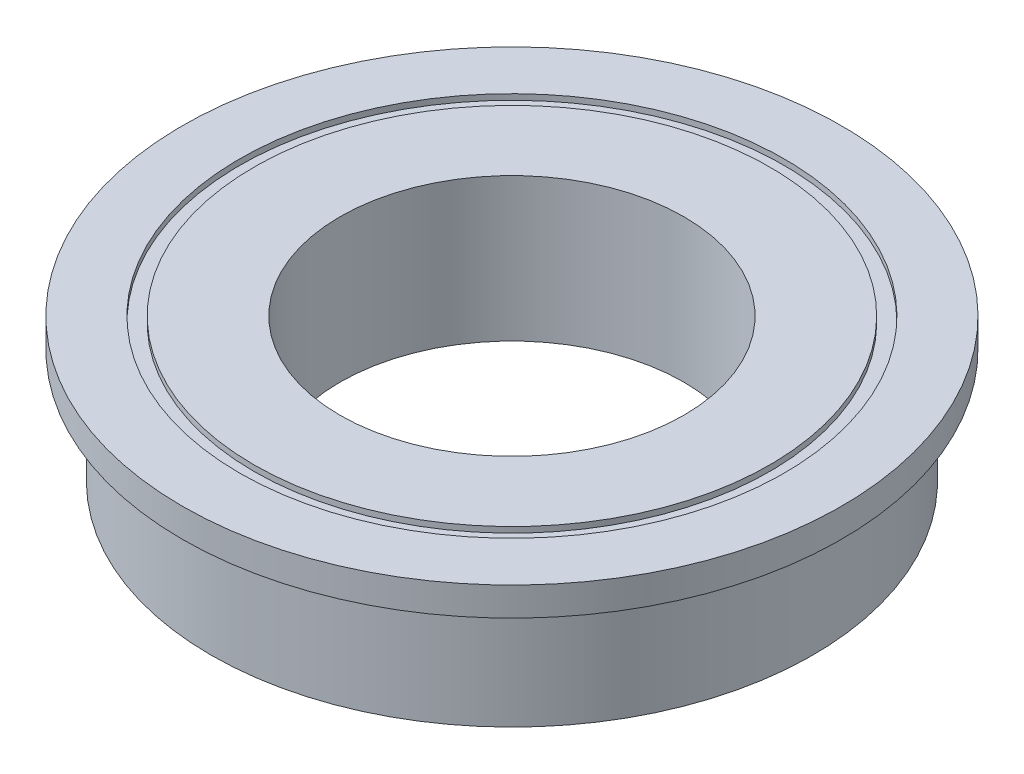
from build123d import *

# Parameters (mm, degrees)
SKETCH_1_R          = 10.5
SKETCH_1_R_2        = 6
EXTRUDE_1_DEPTH     = 4
SKETCH_2_R          = 11.5
SKETCH_2_R_2        = 6
EXTRUDE_2_DEPTH     = 1
SKETCH_3_R          = 9.5
SKETCH_3_R_2        = 9
CUT_EXTRUDE_1_DEPTH = 0.2
CUT_EXTRUDE_START   = -0.2
SKETCH_4_R          = 9.5
SKETCH_4_R_2        = 9
CUT_EXTRUDE_2_DEPTH = 0.2


with BuildPart() as part:
    # 草图1 → 凸台-拉伸1 (new body)
    with BuildSketch(Plane(origin=(0, 0, 0), x_dir=(1, 0, 0), z_dir=(0, 1, 0))):
        with Locations(Location((0, 0, 0), (0, 0, 270))):
            Circle(SKETCH_1_R)
        with Locations(Location((0, 0, 0), (0, 0, 270))):
            Circle(SKETCH_1_R_2, mode=Mode.SUBTRACT)
    extrude(amount=EXTRUDE_1_DEPTH)

    # 草图2 → 凸台-拉伸2 (add)
    with BuildSketch(Plane(origin=(0, 4, 0), x_dir=(1, 0, 0), z_dir=(0, 1, 0))):
        with Locations(Location((0, 0, 0), (0, 0, 270))):
            Circle(SKETCH_2_R)
        with Locations(Location((0, 0, 0), (0, 0, 270))):
            Circle(SKETCH_2_R_2, mode=Mode.SUBTRACT)
    extrude(amount=EXTRUDE_2_DEPTH)

    # 草图3 → 切除-拉伸1 (cut)
    with BuildSketch(Plane.XZ):
        with Locations(Location((0, 0, 0), (0, 0, 270))):
            Circle(SKETCH_3_R)
        with Locations(Location((0, 0, 0), (0, 0, 270))):
            Circle(SKETCH_3_R_2, mode=Mode.SUBTRACT)
    extrude(amount=-CUT_EXTRUDE_1_DEPTH, mode=Mode.SUBTRACT)

    # 草图4 → 切除-拉伸2 (cut)
    with BuildSketch(Plane(origin=(0, 5, 0), x_dir=(1, 0, 0), z_dir=(0, 1, 0)).offset(CUT_EXTRUDE_START)):
        with Locations(Location((0, 0, 0), (0, 0, 90))):
            Circle(SKETCH_4_R)
        with Locations(Location((0, 0, 0), (0, 0, 90))):
            Circle(SKETCH_4_R_2, mode=Mode.SUBTRACT)
    extrude(amount=CUT_EXTRUDE_2_DEPTH, mode=Mode.SUBTRACT)


solid = part.part
